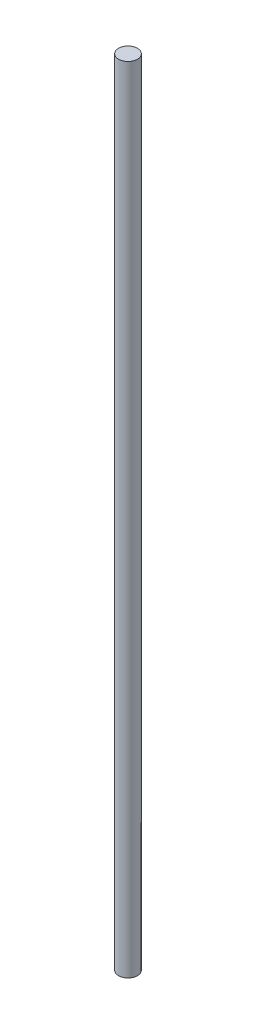
from build123d import *

# Parameters (mm, degrees)
SKETCH2_R           = 25.4
BOSS_EXTRUDE1_DEPTH = 2133.6


with BuildPart() as part:
    # Sketch2 → Boss-Extrude1 (new body)
    with BuildSketch(Plane(origin=(0, 0, 0), x_dir=(1, 0, 0), z_dir=(0, 1, 0))):
        with Locations(Location((0, 0, 0), (0, 0, 270))):
            Circle(SKETCH2_R)
    extrude(amount=BOSS_EXTRUDE1_DEPTH)


solid = part.part
